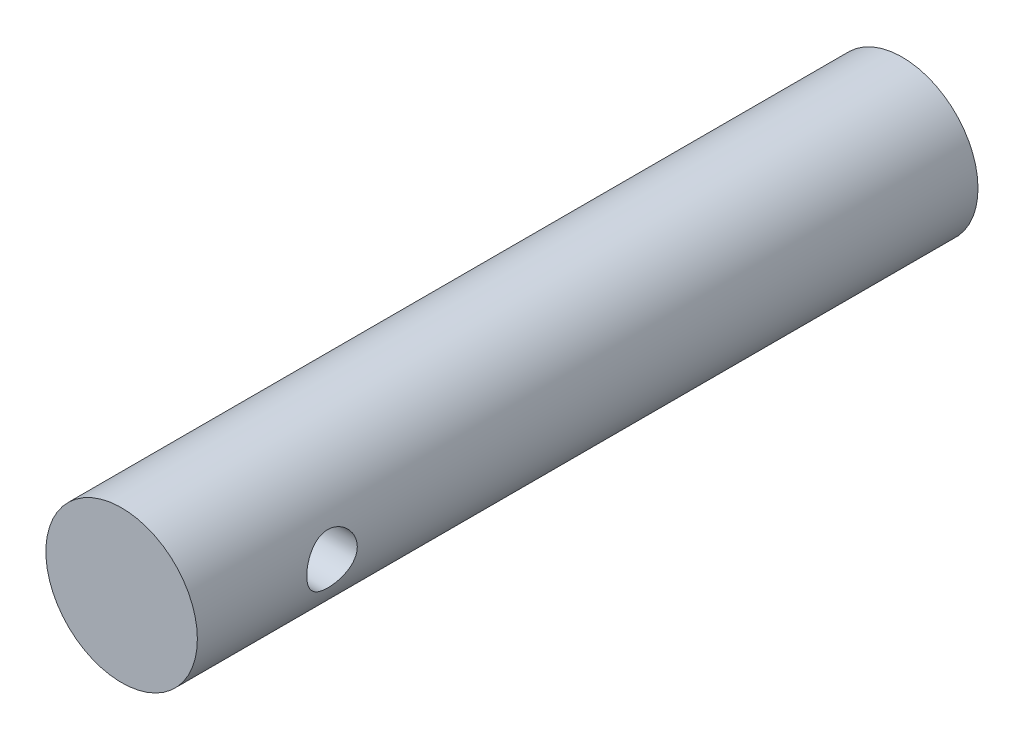
from build123d import *

# Parameters (mm, degrees)
SKETCH1_R               = 5.715
BASE_EXTRUDE_DEPTH      = 58.890916
CUT_EXTRUDE1_DEPTH      = 60.442934293
CUT_EXTRUDE1_DEPTH_BACK = 60.442934293
SKETCH2_R               = 1.905


with BuildPart() as part:
    # Sketch1 → Base-Extrude (new body)
    with BuildSketch(Plane.XY):
        Circle(SKETCH1_R)
    extrude(amount=-BASE_EXTRUDE_DEPTH)

    # Sketch2 → Cut-Extrude1 (cut, two sides: drawn at the far end of the back side and taken through both)
    with BuildSketch(Plane(origin=(0, 0, 0), x_dir=(0, 0, -1), z_dir=(1, 0, 0)).offset(-CUT_EXTRUDE1_DEPTH_BACK)):
        with Locations((10.16, 0)):
            Circle(SKETCH2_R)
    extrude(amount=CUT_EXTRUDE1_DEPTH + CUT_EXTRUDE1_DEPTH_BACK, mode=Mode.SUBTRACT)


solid = part.part
